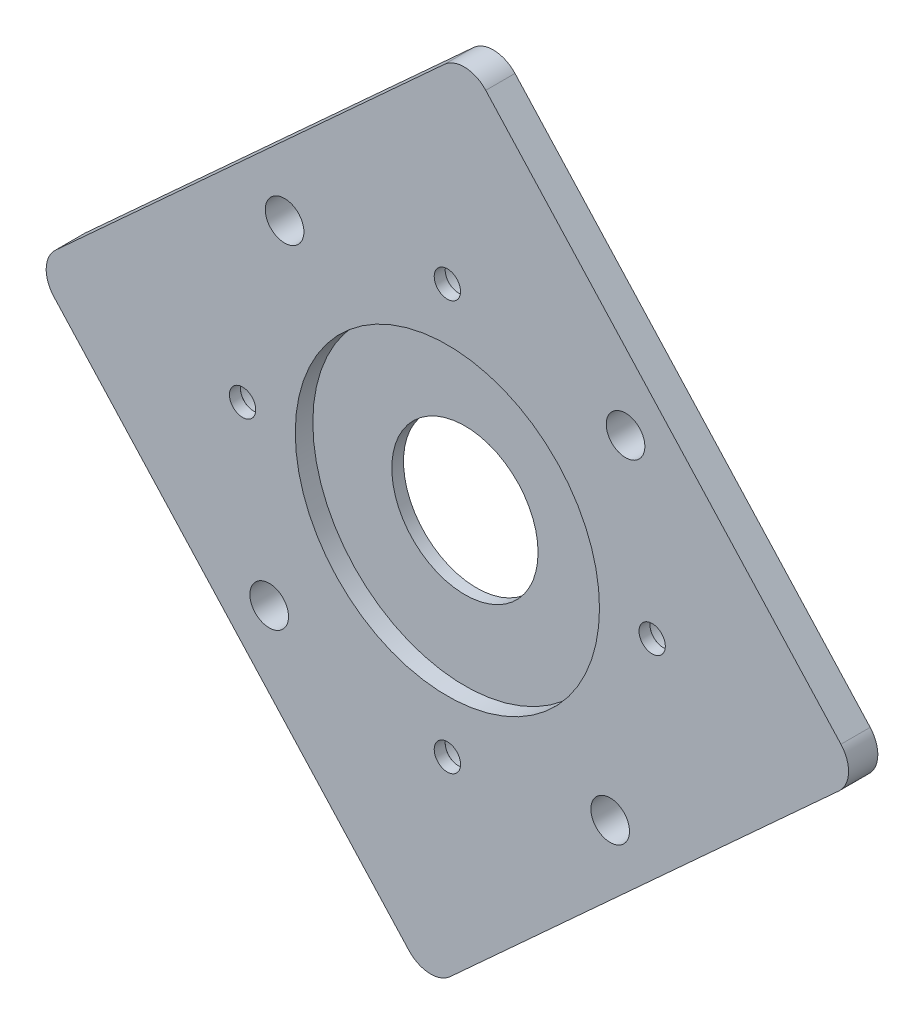
from build123d import *

# Parameters (mm, degrees)
ESQUISSE1_R                                = 50
BOSS_EXTRU_1_DEPTH                         = 5
ESQUISSE2_R                                = 26
ENL_V_MAT_EXTRU_1_DEPTH                    = 3
ESQUISSE3_R                                = 12.5
ENL_V_MAT_EXTRU_2_DEPTH                    = 71.887234394
CHAMBRAGE_POUR_VIS_T_TE_RONDE_BOMB_2_COUNT = 2
CHAMBRAGE_POUR_VIS_T_TE_RONDE_BOMB_2_PITCH = 49.497474683
CHAMBRAGE_POUR_VIS_T_TE_RONDE_BOMB_3_COUNT = 2
CHAMBRAGE_POUR_VIS_T_TE_RONDE_BOMB_3_PITCH = 70
CHAMBRAGE_POUR_VIS_T_TE_RONDE_BOMB_4_COUNT = 2
CHAMBRAGE_POUR_VIS_T_TE_RONDE_BOMB_4_PITCH = 49.497474683
D_GAGEMENT_M62_D                           = 6.6
BOSS_EXTRU_3_DEPTH                         = 5


with BuildPart() as part:
    # Esquisse1 → Boss.-Extru.1 (new body)
    with BuildSketch(Plane.XY):
        Circle(ESQUISSE1_R)
    extrude(amount=BOSS_EXTRU_1_DEPTH)

    # Esquisse2 → Enlèv. mat.-Extru.1 (cut)
    with BuildSketch(Plane.XY.offset(5)):
        Circle(ESQUISSE2_R)
    extrude(amount=-ENL_V_MAT_EXTRU_1_DEPTH, mode=Mode.SUBTRACT)

    # Esquisse3 → Enlèv. mat.-Extru.2 (cut, through all)
    with BuildSketch(Plane.XY.offset(5)):
        Circle(ESQUISSE3_R)
    extrude(amount=-ENL_V_MAT_EXTRU_2_DEPTH, mode=Mode.SUBTRACT)

    # Esquisse5 → Chambrage pour vis à tête ronde bombée M41 (revolve, cut)
    with BuildSketch(Plane(origin=(0, 35, 0), x_dir=(0, 1, 0), z_dir=(1, 0, 0))):
        Polygon((0, 0), (0, 5), (2.25, 5), (2.25, 3.125), (2.275, 3.1), (4.5, 3.1), (4.5, 0), align=None)
    chambrage_pour_vis_t_te_ronde_bomb_e_m = revolve(axis=Axis((0, 35, -6.35), (0, 0, 1)), mode=Mode.SUBTRACT)

    # Chambrage pour vis _ t_te ronde bomb 2: Chambrage pour vis à tête ronde bombée M41 ×2
    with Locations(*[Vector(-0.7071067811865476, -0.7071067811865476, 0) * (i * CHAMBRAGE_POUR_VIS_T_TE_RONDE_BOMB_2_PITCH) for i in range(1, CHAMBRAGE_POUR_VIS_T_TE_RONDE_BOMB_2_COUNT)]):
        add(chambrage_pour_vis_t_te_ronde_bomb_e_m, mode=Mode.SUBTRACT)

    # Chambrage pour vis _ t_te ronde bomb 3: Chambrage pour vis à tête ronde bombée M41 ×2
    with Locations(*[(0, -i * CHAMBRAGE_POUR_VIS_T_TE_RONDE_BOMB_3_PITCH, 0) for i in range(1, CHAMBRAGE_POUR_VIS_T_TE_RONDE_BOMB_3_COUNT)]):
        add(chambrage_pour_vis_t_te_ronde_bomb_e_m, mode=Mode.SUBTRACT)

    # Chambrage pour vis _ t_te ronde bomb 4: Chambrage pour vis à tête ronde bombée M41 ×2
    with Locations(*[Vector(0.7071067811865476, -0.7071067811865476, 0) * (i * CHAMBRAGE_POUR_VIS_T_TE_RONDE_BOMB_4_PITCH) for i in range(1, CHAMBRAGE_POUR_VIS_T_TE_RONDE_BOMB_4_COUNT)]):
        add(chambrage_pour_vis_t_te_ronde_bomb_e_m, mode=Mode.SUBTRACT)

    # Dégagement M62 (through all)
    with Locations(Plane.XY.offset(5)):
        with Locations((30.452660491, 27.824413184), (-27.824413184, 30.452660491), (-30.452660491, -27.824413184), (27.824413184, -30.452660491)):
            Hole(D_GAGEMENT_M62_D / 2)

    # Esquisse12 → Boss.-Extru.3 (add)
    with BuildSketch(Plane(origin=(0, 0, 0), x_dir=(-1, 0, 0), z_dir=(0, 0, -1))):
        with BuildLine():
            ThreePointArc((-67.266221038, 0.505477263), (-68.56991237, -3.092445728), (-66.947645607, -6.558410455))
            Line((-66.947645607, -6.558410455), (-33.726561375, -36.912315801))
            ThreePointArc((-33.726561375, -36.912315801), (-49.949229092, -2.252667991), (-36.912315035, 33.726562214))
            Line((-36.912315035, 33.726562214), (-67.266221038, 0.505477263))
        make_face()
        with BuildLine():
            ThreePointArc((36.912315932, -33.726561232), (2.252668655, -49.949229062), (-33.726561375, -36.912315801))
            Line((-33.726561375, -36.912315801), (-0.505477263, -67.266221038))
            ThreePointArc((-0.505477263, -67.266221038), (3.092445728, -68.56991237), (6.558410455, -66.947645607))
            Line((6.558410455, -66.947645607), (36.912315932, -33.726561232))
        make_face()
        with BuildLine():
            Line((-6.558410455, 66.947645607), (-36.912315035, 33.726562214))
            ThreePointArc((-36.912315035, 33.726562214), (-2.252667991, 49.949229092), (33.726561375, 36.912315801))
            Line((33.726561375, 36.912315801), (0.505477263, 67.266221038))
            ThreePointArc((0.505477263, 67.266221038), (-3.092445728, 68.56991237), (-6.558410455, 66.947645607))
        make_face()
        with BuildLine():
            ThreePointArc((33.726561375, 36.912315801), (49.949229062, 2.252668655), (36.912315932, -33.726561232))
            Line((36.912315932, -33.726561232), (67.266221038, -0.505477263))
            ThreePointArc((67.266221038, -0.505477263), (68.56991237, 3.092445728), (66.947645607, 6.558410455))
            Line((66.947645607, 6.558410455), (33.726561375, 36.912315801))
        make_face()
    extrude(amount=-BOSS_EXTRU_3_DEPTH)


solid = part.part
